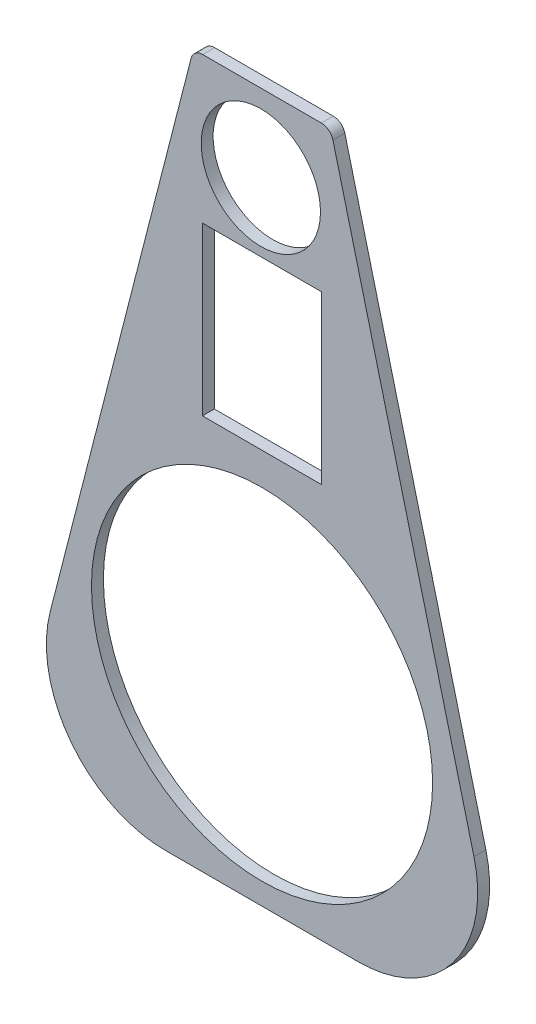
from build123d import *

# Parameters (mm, degrees)
SKETCH3_R           = 250
SKETCH3_R_2         = 715
SKETCH3_W           = 500
SKETCH3_H           = 700
BOSS_EXTRUDE1_DEPTH = 50


with BuildPart() as part:
    # Sketch3 → Boss-Extrude1 (new body)
    with BuildSketch(Plane.XY):
        with BuildLine():
            Line((953.699706136, -1070.104718306), (362.516639902, 1235.936167947))
            ThreePointArc((362.516639902, 1235.936167947), (344.735540122, 1263.021649549), (314.082893486, 1273.519557779))
            Line((314.082893486, 1273.519557779), (-183.451796134, 1273.519557779))
            ThreePointArc((-183.451796134, 1273.519557779), (-214.10444277, 1263.021649549), (-231.885542551, 1235.936167947))
            Line((-231.885542551, 1235.936167947), (-823.068608784, -1070.104718306))
            ThreePointArc((-823.068608784, -1070.104718306), (-733.752062318, -1500.797286347), (-338.731144619, -1694.270819985))
            Line((-338.731144619, -1694.270819985), (469.362241971, -1694.270819985))
            ThreePointArc((469.362241971, -1694.270819985), (864.383159669, -1500.797286347), (953.699706136, -1070.104718306))
        make_face()
        with Locations((60.29466546, 948.352728731)):
            Circle(SKETCH3_R, mode=Mode.SUBTRACT)
        with Locations((65.315548676, -888.891859179)):
            Circle(SKETCH3_R_2, mode=Mode.SUBTRACT)
        with Locations((65.315548676, 311.108140821)):
            Rectangle(SKETCH3_W, SKETCH3_H, mode=Mode.SUBTRACT)
    extrude(amount=BOSS_EXTRUDE1_DEPTH)


solid = part.part
